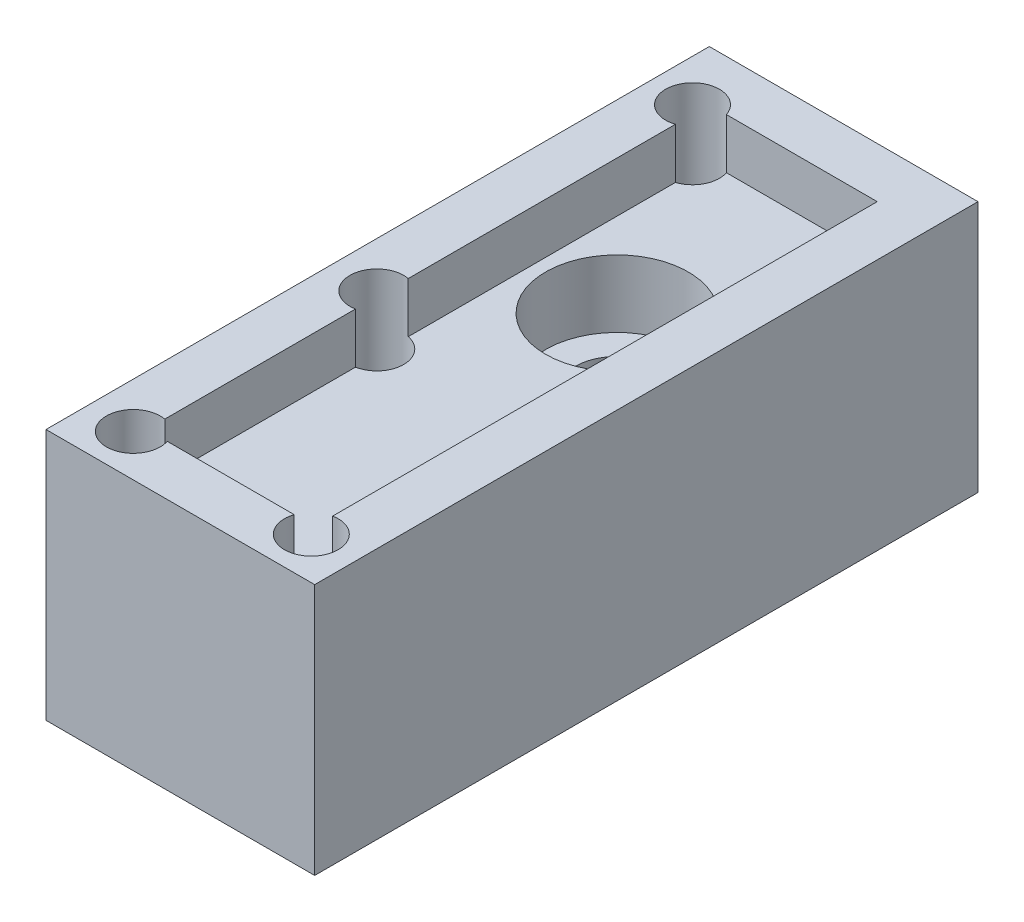
from build123d import *

# Parameters (mm, degrees)
SKETCH1_W               = 16
SKETCH1_H               = 39.5
BOSS_EXTRUDE1_DEPTH     = 15
SKETCH2_W               = 10
SKETCH2_H               = 33.5
CUT_EXTRUDE1_DEPTH      = 3
CUT_EXTRUDE2_DEPTH      = 45.274710615
CUT_EXTRUDE2_DEPTH_BACK = 45.274710615
SKETCH3_R               = 1.6
CUT_EXTRUDE3_DEPTH      = 3
CUT_EXTRUDE3_DEPTH_BACK = 46.180194776
SKETCH4_R               = 1.6
SKETCH5_R               = 2.5
CUT_EXTRUDE4_DEPTH      = 20
SKETCH7_R               = 4.25
CUT_EXTRUDE5_DEPTH      = 4


with BuildPart() as part:
    # Sketch1 → Boss-Extrude1 (new body)
    with BuildSketch(Plane(origin=(0, 0, 0), x_dir=(1, 0, 0), z_dir=(0, 1, 0))):
        with Locations((8, 19.75)):
            Rectangle(SKETCH1_W, SKETCH1_H)
    extrude(amount=BOSS_EXTRUDE1_DEPTH)

    # Sketch2 → Cut-Extrude1 (cut)
    with BuildSketch(Plane(origin=(0, 15, 0), x_dir=(1, 0, 0), z_dir=(0, 1, 0))):
        with Locations((8, 19.75)):
            Rectangle(SKETCH2_W, SKETCH2_H)
    extrude(amount=-CUT_EXTRUDE1_DEPTH, mode=Mode.SUBTRACT)

    # Sketch3 → Cut-Extrude2 (cut, two sides: drawn at the far end of the back side and taken through both)
    with BuildSketch(Plane(origin=(0, 12, 0), x_dir=(1, 0, 0), z_dir=(0, 1, 0)).offset(-CUT_EXTRUDE2_DEPTH_BACK)):
        with Locations((2.7, 2.5)):
            Circle(SKETCH3_R)
    extrude(amount=CUT_EXTRUDE2_DEPTH + CUT_EXTRUDE2_DEPTH_BACK, mode=Mode.SUBTRACT)

    # Sketch4 → Cut-Extrude3 (cut, two sides: drawn at the far end of the back side and taken through both)
    with BuildSketch(Plane(origin=(0, 15, 0), x_dir=(1, 0, 0), z_dir=(0, 1, 0)).offset(-CUT_EXTRUDE3_DEPTH_BACK)):
        with Locations((13.3, 2.5)):
            Circle(SKETCH4_R)
        with Locations((2.7, 17)):
            Circle(SKETCH4_R)
        with Locations((2.5, 36)):
            Circle(SKETCH4_R)
    extrude(amount=CUT_EXTRUDE3_DEPTH + CUT_EXTRUDE3_DEPTH_BACK, mode=Mode.SUBTRACT)

    # Sketch5 → Cut-Extrude4 (cut)
    with BuildSketch(Plane(origin=(0, 12, 0), x_dir=(1, 0, 0), z_dir=(0, 1, 0))):
        with Locations((8, 26)):
            Circle(SKETCH5_R)
    extrude(amount=-CUT_EXTRUDE4_DEPTH, mode=Mode.SUBTRACT)

    # Sketch7 → Cut-Extrude5 (cut)
    with BuildSketch(Plane(origin=(0, 12, 0), x_dir=(1, 0, 0), z_dir=(0, 1, 0))):
        with Locations((8, 26)):
            Circle(SKETCH7_R)
    extrude(amount=-CUT_EXTRUDE5_DEPTH, mode=Mode.SUBTRACT)


solid = part.part
